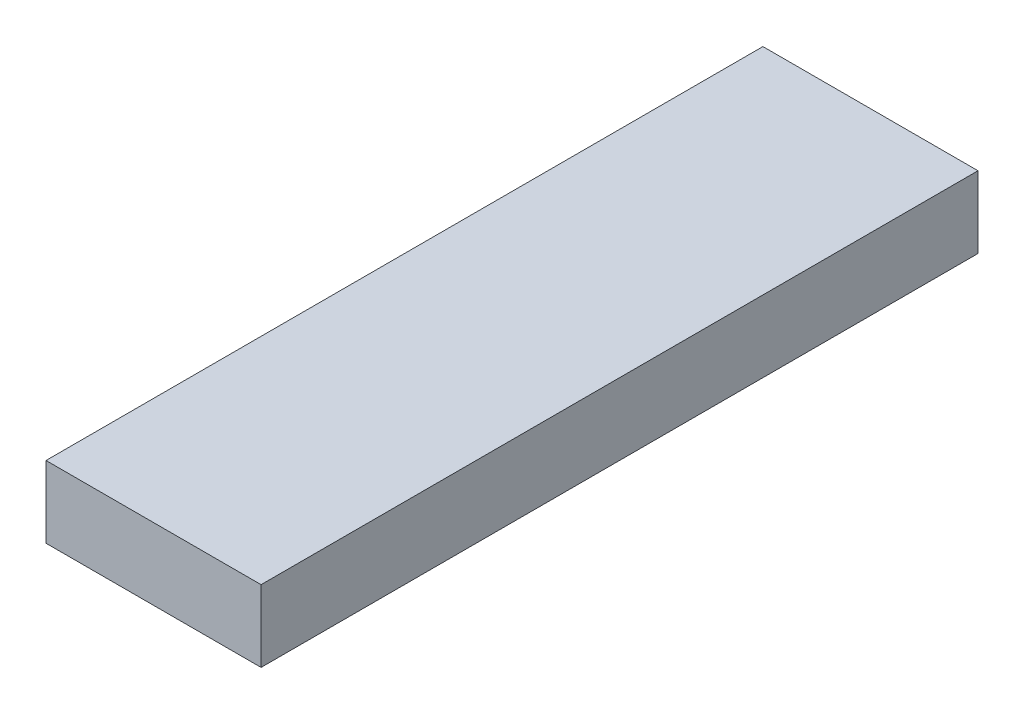
from build123d import *

# Parameters (mm, degrees)
SKETCH_2_W      = 180
SKETCH_2_H      = 60
EXTRUDE_1_DEPTH = 600


with BuildPart() as part:
    # 草图2 → 凸台-拉伸1 (new body)
    with BuildSketch(Plane.XY):
        Rectangle(SKETCH_2_W, SKETCH_2_H)
    extrude(amount=EXTRUDE_1_DEPTH)


solid = part.part
